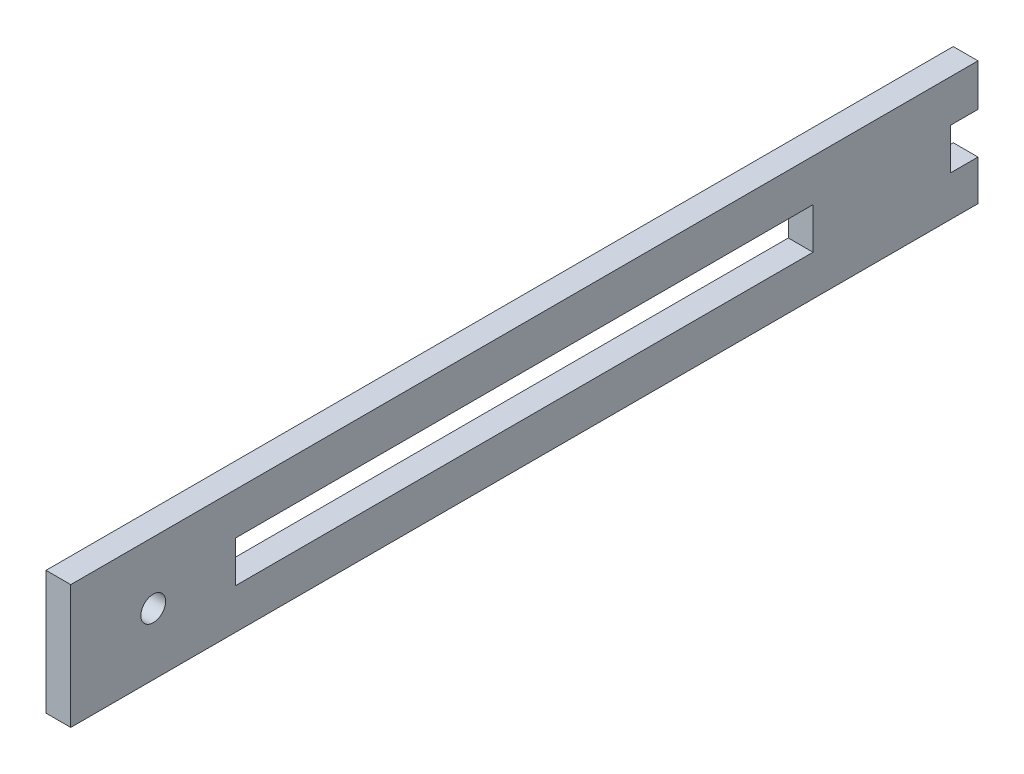
from build123d import *

# Parameters (mm, degrees)
SKETCH1_W           = 110
SKETCH1_H           = 15
SKETCH1_W_2         = 70
SKETCH1_H_2         = 5
BOSS_EXTRUDE1_DEPTH = 3
SKETCH2_R           = 1.5
SKETCH2_W           = 3.323826254
SKETCH2_H           = 5
CUT_EXTRUDE1_DEPTH  = 56.590017089


with BuildPart() as part:
    # Sketch1 → Boss-Extrude1 (new body)
    with BuildSketch(Plane(origin=(0, 0, 0), x_dir=(0, 0, -1), z_dir=(1, 0, 0))):
        Rectangle(SKETCH1_W, SKETCH1_H)
        with Locations((0, -0.10154628)):
            Rectangle(SKETCH1_W_2, SKETCH1_H_2, mode=Mode.SUBTRACT)
    extrude(amount=BOSS_EXTRUDE1_DEPTH)

    # Sketch2 → Cut-Extrude1 (cut, through all)
    with BuildSketch(Plane(origin=(3, 0, 0), x_dir=(0, 0, -1), z_dir=(1, 0, 0))):
        with Locations((-45, 0)):
            Circle(SKETCH2_R)
        with Locations((53.338086873, -0.10154628)):
            Rectangle(SKETCH2_W, SKETCH2_H)
    extrude(amount=-CUT_EXTRUDE1_DEPTH, mode=Mode.SUBTRACT)


solid = part.part
